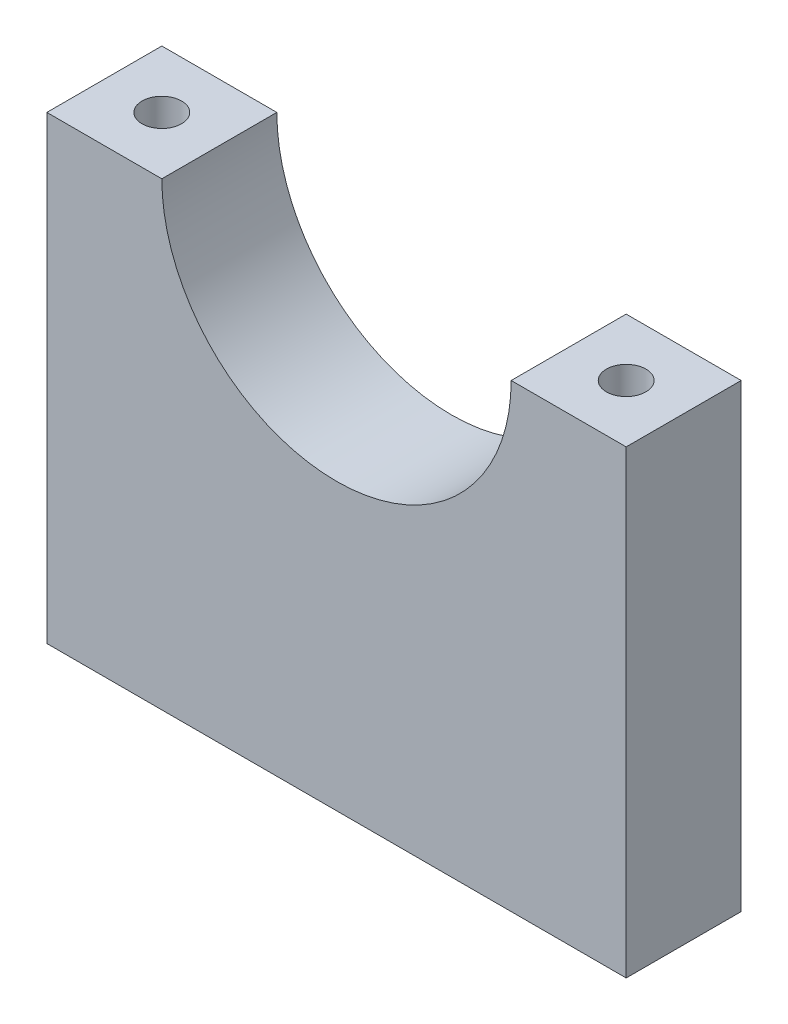
from build123d import *

# Parameters (mm, degrees)
BOSS_EXTRUDE1_DEPTH = 12.7
SKETCH2_R           = 2.1828125
CUT_EXTRUDE1_DEPTH  = 62.362637457


with BuildPart() as part:
    # Sketch1 → Boss-Extrude1 (new body)
    with BuildSketch(Plane.XY):
        with BuildLine():
            Line((-31.9913, 0), (-19.2913, 0))
            ThreePointArc((-19.2913, 0), (0, -19.2913), (19.2913, 0))
            Line((19.2913, 0), (31.9913, 0))
            Line((31.9913, 0), (31.9913, -50.8))
            Line((31.9913, -50.8), (-31.9913, -50.8))
            Line((-31.9913, -50.8), (-31.9913, 0))
        make_face()
    extrude(amount=BOSS_EXTRUDE1_DEPTH)

    # Sketch2 → Cut-Extrude1 (cut, through all)
    with BuildSketch(Plane.XZ.offset(50.8)):
        with Locations((-25.6413, 6.35)):
            Circle(SKETCH2_R)
        with Locations((25.6413, 6.35)):
            Circle(SKETCH2_R)
    extrude(amount=-CUT_EXTRUDE1_DEPTH, mode=Mode.SUBTRACT)


solid = part.part
